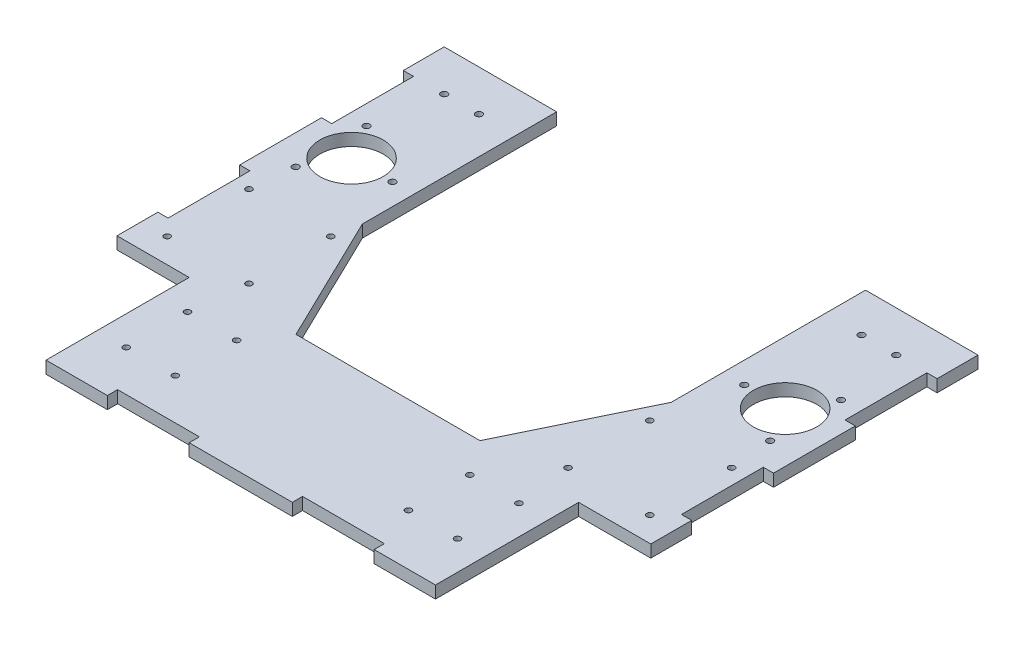
from build123d import *

# Parameters (mm, degrees)
BOSS_EXTRUDE1_DEPTH     = 6
SKETCH4_W               = 35.287296169
SKETCH4_H               = 70
CUT_EXTRUDE1_DEPTH      = 10
SKETCH8_W               = 55
SKETCH8_H               = 6
BOSS_EXTRUDE2_DEPTH     = 30
SKETCH10_W              = 5
SKETCH10_H              = 40
SKETCH10_W_2            = 40
SKETCH10_H_2            = 5
CUT_EXTRUDE2_DEPTH      = 10
SKETCH11_R              = 1.5
CUT_EXTRUDE3_DEPTH      = 10
SKETCH12_R              = 1.6
CUT_EXTRUDE4_DEPTH      = 27
SKETCH13_R              = 1.6
CUT_EXTRUDE5_DEPTH      = 39
SKETCH14_R              = 1.6
SKETCH14_R_2            = 1.5
CUT_EXTRUDE6_DEPTH      = 10
CUT_EXTRUDE7_DEPTH      = 436.116515514
CUT_EXTRUDE7_DEPTH_BACK = 15
SKETCH15_R              = 15.5
CUT_EXTRUDE8_DEPTH      = 436.116515514
CUT_EXTRUDE8_DEPTH_BACK = 436.116515514
SKETCH16_R              = 15.5


with BuildPart() as part:
    # Sketch3 → Boss-Extrude1 (new body)
    with BuildSketch(Plane(origin=(0, 0, 0), x_dir=(1, 0, 0), z_dir=(0, 1, 0))):
        Polygon((-85.132929843, 76.727687575), (-85.132929843, -123.272312425), (175.891655366, -123.272312425), (175.891655366, 76.727687575), (120.891655366, 76.727687575), (120.891655366, 11.727687575), (90.379362761, -51.272312425), (0.379362761, -51.272312425), (-30.132929843, 11.727687575), (-30.132929843, 76.727687575), align=None)
    extrude(amount=BOSS_EXTRUDE1_DEPTH)

    # Sketch4 → Cut-Extrude1 (cut)
    with BuildSketch(Plane(origin=(0, 6, 0), x_dir=(1, 0, 0), z_dir=(0, 1, 0))):
        with Locations((-67.489281758, -88.272312425)):
            Rectangle(SKETCH4_W, SKETCH4_H)
        with Locations((158.248007282, -88.272312425)):
            Rectangle(SKETCH4_W, SKETCH4_H)
    extrude(amount=-CUT_EXTRUDE1_DEPTH, mode=Mode.SUBTRACT)

    # Sketch8 → Boss-Extrude2 (add)
    with BuildSketch(Plane(origin=(0, 0, -76.727687575), x_dir=(-1, 0, 0), z_dir=(0, 0, -1))):
        with Locations((-148.391655366, 3)):
            Rectangle(SKETCH8_W, SKETCH8_H)
        with Locations((57.632929843, 3)):
            Rectangle(SKETCH8_W, SKETCH8_H)
    extrude(amount=BOSS_EXTRUDE2_DEPTH)

    # Sketch10 → Cut-Extrude2 (cut)
    with BuildSketch(Plane(origin=(0, 6, 0), x_dir=(1, 0, 0), z_dir=(0, 1, 0))):
        with Locations((-82.632929843, 66.727687575)):
            Rectangle(SKETCH10_W, SKETCH10_H)
        with Locations((-82.632929843, -13.272312425)):
            Rectangle(SKETCH10_W, SKETCH10_H)
        with Locations((173.391655366, -13.272312425)):
            Rectangle(SKETCH10_W, SKETCH10_H)
        with Locations((173.391655366, 66.727687575)):
            Rectangle(SKETCH10_W, SKETCH10_H)
        with Locations((0.154366326, -120.772312425)):
            Rectangle(SKETCH10_W_2, SKETCH10_H_2)
        with Locations((90.604359197, -120.772312425)):
            Rectangle(SKETCH10_W_2, SKETCH10_H_2)
    extrude(amount=-CUT_EXTRUDE2_DEPTH, mode=Mode.SUBTRACT)

    # Sketch11 → Cut-Extrude3 (cut)
    with BuildSketch(Plane(origin=(0, 0, 0), x_dir=(1, 0, 0), z_dir=(0, 1, 0))):
        with Locations((-35.632929843, -68.272312425)):
            Circle(SKETCH11_R)
        with Locations((-11.632929843, -68.272312425)):
            Circle(SKETCH11_R)
        with Locations((-11.632929843, -98.272312425)):
            Circle(SKETCH11_R)
        with Locations((-35.632929843, -98.272312425)):
            Circle(SKETCH11_R)
        with Locations((102.391655366, -68.272312425)):
            Circle(SKETCH11_R)
        with Locations((102.391655366, -98.272312425)):
            Circle(SKETCH11_R)
        with Locations((126.391655366, -98.272312425)):
            Circle(SKETCH11_R)
        with Locations((126.391655366, -68.272312425)):
            Circle(SKETCH11_R)
    extrude(amount=CUT_EXTRUDE3_DEPTH, mode=Mode.SUBTRACT)

    # Sketch12 → Cut-Extrude4 (cut)
    with BuildSketch(Plane(origin=(0, 0, 0), x_dir=(1, 0, 0), z_dir=(0, 1, 0))):
        with Locations((138.891655366, 86.727687575)):
            Circle(SKETCH12_R)
        with Locations((155.891655366, 86.727687575)):
            Circle(SKETCH12_R)
    extrude(amount=CUT_EXTRUDE4_DEPTH, mode=Mode.SUBTRACT)

    # Sketch13 → Cut-Extrude5 (cut)
    with BuildSketch(Plane(origin=(0, 0, 0), x_dir=(1, 0, 0), z_dir=(0, 1, 0))):
        with Locations((-65.132929843, 86.727687575)):
            Circle(SKETCH13_R)
        with Locations((-48.132929843, 86.727687575)):
            Circle(SKETCH13_R)
    extrude(amount=CUT_EXTRUDE5_DEPTH, mode=Mode.SUBTRACT)

    # Sketch14 → Cut-Extrude6 (cut)
    with BuildSketch(Plane(origin=(0, 0, 0), x_dir=(1, 0, 0), z_dir=(0, 1, 0))):
        with Locations((-70.632929843, 54.227687575)):
            Circle(SKETCH14_R)
        with Locations((-40.632929843, 36.907179499)):
            Circle(SKETCH14_R)
        with Locations((-70.632929843, 19.586671424)):
            Circle(SKETCH14_R)
        with Locations((-72.632929843, -1.247312425)):
            Circle(SKETCH14_R_2)
        with Locations((-32.632929843, -1.247312425)):
            Circle(SKETCH14_R_2)
        with Locations((-32.632929843, -41.247312425)):
            Circle(SKETCH14_R_2)
        with Locations((-72.632929843, -41.247312425)):
            Circle(SKETCH14_R_2)
        with Locations((163.391655366, -41.247312425)):
            Circle(SKETCH14_R_2)
        with Locations((123.391655366, -41.247312425)):
            Circle(SKETCH14_R_2)
        with Locations((123.391655366, -1.247312425)):
            Circle(SKETCH14_R_2)
        with Locations((163.391655366, -1.247312425)):
            Circle(SKETCH14_R_2)
        with Locations((161.391655366, 19.586671424)):
            Circle(SKETCH14_R)
        with Locations((131.391655366, 36.907179499)):
            Circle(SKETCH14_R)
        with Locations((161.391655366, 54.227687575)):
            Circle(SKETCH14_R)
    extrude(amount=CUT_EXTRUDE6_DEPTH, mode=Mode.SUBTRACT)

    # Sketch15 → Cut-Extrude7 (cut, two sides: drawn at the far end of the back side and taken through both)
    with BuildSketch(Plane(origin=(-65.954618325, -135.210856749, -209.738582158), x_dir=(1, 0, 0), z_dir=(0, 1, 0)).offset(-CUT_EXTRUDE7_DEPTH_BACK)):
        with Locations((5.321688481, -172.831402658)):
            Circle(SKETCH15_R)
    extrude(amount=CUT_EXTRUDE7_DEPTH + CUT_EXTRUDE7_DEPTH_BACK, mode=Mode.SUBTRACT)

    # Sketch16 → Cut-Extrude8 (cut, two sides: drawn at the far end of the back side and taken through both)
    with BuildSketch(Plane(origin=(-65.954618325, -135.210856749, -209.738582158), x_dir=(1, 0, 0), z_dir=(0, 1, 0)).offset(-CUT_EXTRUDE8_DEPTH_BACK)):
        with Locations((217.346273691, -172.831402658)):
            Circle(SKETCH16_R)
    extrude(amount=CUT_EXTRUDE8_DEPTH + CUT_EXTRUDE8_DEPTH_BACK, mode=Mode.SUBTRACT)


solid = part.part
